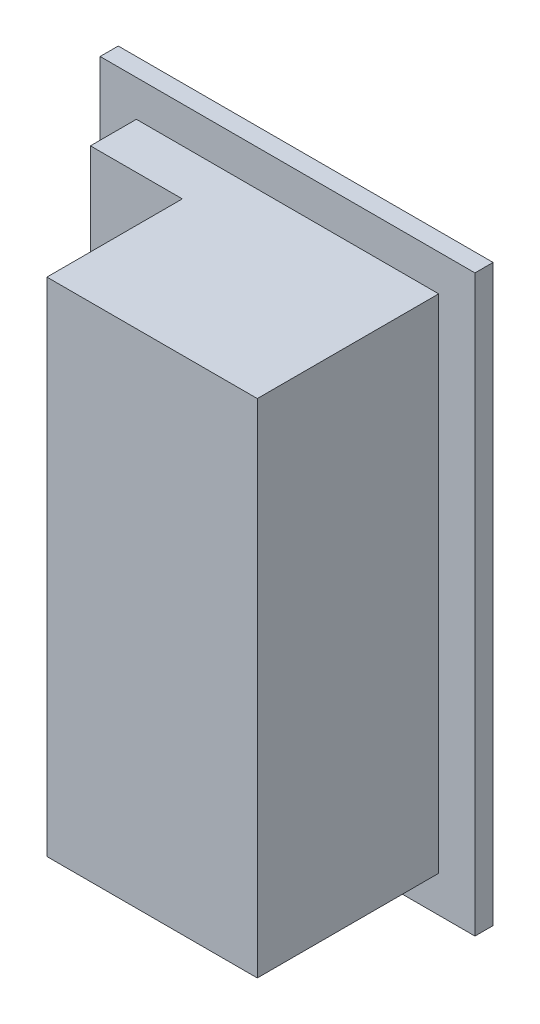
from build123d import *

# Parameters (mm, degrees)
ESBO_O1_W                = 31
ESBO_O1_H                = 47.5
ESBO_O1_W_2              = 24
ESBO_O1_H_2              = 41.5
RESSALTO_EXTRUS_O1_DEPTH = 1.5
RESSALTO_EXTRUS_O2_DEPTH = 16.5
RESSALTO_EXTRUS_O3_START = 16.5
ESBO_O1_5_W              = 23
ESBO_O1_5_H              = 39.5
RESSALTO_EXTRUS_O3_DEPTH = 1
ESBO_O2_W                = 6.6
ESBO_O2_H                = 41.5
CORTE_EXTRUS_O1_DEPTH    = 15
RESSALTO_EXTRUS_O6_START = -1
RESSALTO_EXTRUS_O6_DEPTH = 39.5
ESBO_O4_W                = 3.8
ESBO_O4_H                = 1
RESSALTO_EXTRUS_O9_DEPTH = 7.6


with BuildPart() as part:
    # Esboço1 → Ressalto-extrusão1 (new body)
    with BuildSketch(Plane.XY):
        with Locations((11.5, 20.75)):
            Rectangle(ESBO_O1_W, ESBO_O1_H)
        with Locations((12, 20.75)):
            Rectangle(ESBO_O1_W_2, ESBO_O1_H_2, mode=Mode.SUBTRACT)
    extrude(amount=RESSALTO_EXTRUS_O1_DEPTH)

    # Esboço1<4> → Ressalto-extrusão2 (add)
    with BuildSketch(Plane.XY):
        Polygon((0, 41.5), (0, 40.5), (23, 40.5), (23, 1), (0, 1), (0, 0), (24, 0), (24, 41.5), align=None)
    extrude(amount=RESSALTO_EXTRUS_O2_DEPTH)

    # Esboço1<5> → Ressalto-extrusão3 (add)
    with BuildSketch(Plane.XY.offset(RESSALTO_EXTRUS_O3_START)):
        with Locations((11.5, 20.75)):
            Rectangle(ESBO_O1_5_W, ESBO_O1_5_H)
    extrude(amount=-RESSALTO_EXTRUS_O3_DEPTH)

    # Esboço2 → Corte-extrusão1 (cut)
    with BuildSketch(Plane.XY.offset(16.5)):
        with Locations((3.3, 20.75)):
            Rectangle(ESBO_O2_W, ESBO_O2_H)
    extrude(amount=-CORTE_EXTRUS_O1_DEPTH, mode=Mode.SUBTRACT)



with BuildPart() as body_2:
    # Esboço3 → Ressalto-extrusão6 (new body)
    with BuildSketch(Plane(origin=(0, 41.5, 0), x_dir=(1, 0, 0), z_dir=(0, 1, 0)).offset(RESSALTO_EXTRUS_O6_START)):
        Polygon((-1, -1.5), (-1, -5.3), (6.6, -5.3), (6.6, -4.3), (0, -4.3), (0, -1.5), align=None)
    extrude(amount=-RESSALTO_EXTRUS_O6_DEPTH)


with BuildPart() as part_1:
    add(part.part)

    add(body_2.part)  # Ressalto-extrusão9 merges body 2
    # Esboço4 → Ressalto-extrusão9 (add)
    with BuildSketch(Plane.ZY.offset(-6.6)):
        with Locations((3.4, 41)):
            Rectangle(ESBO_O4_W, ESBO_O4_H)
        with Locations((3.4, 0.5)):
            Rectangle(ESBO_O4_W, ESBO_O4_H)
    extrude(amount=RESSALTO_EXTRUS_O9_DEPTH)


solid = part_1.part
